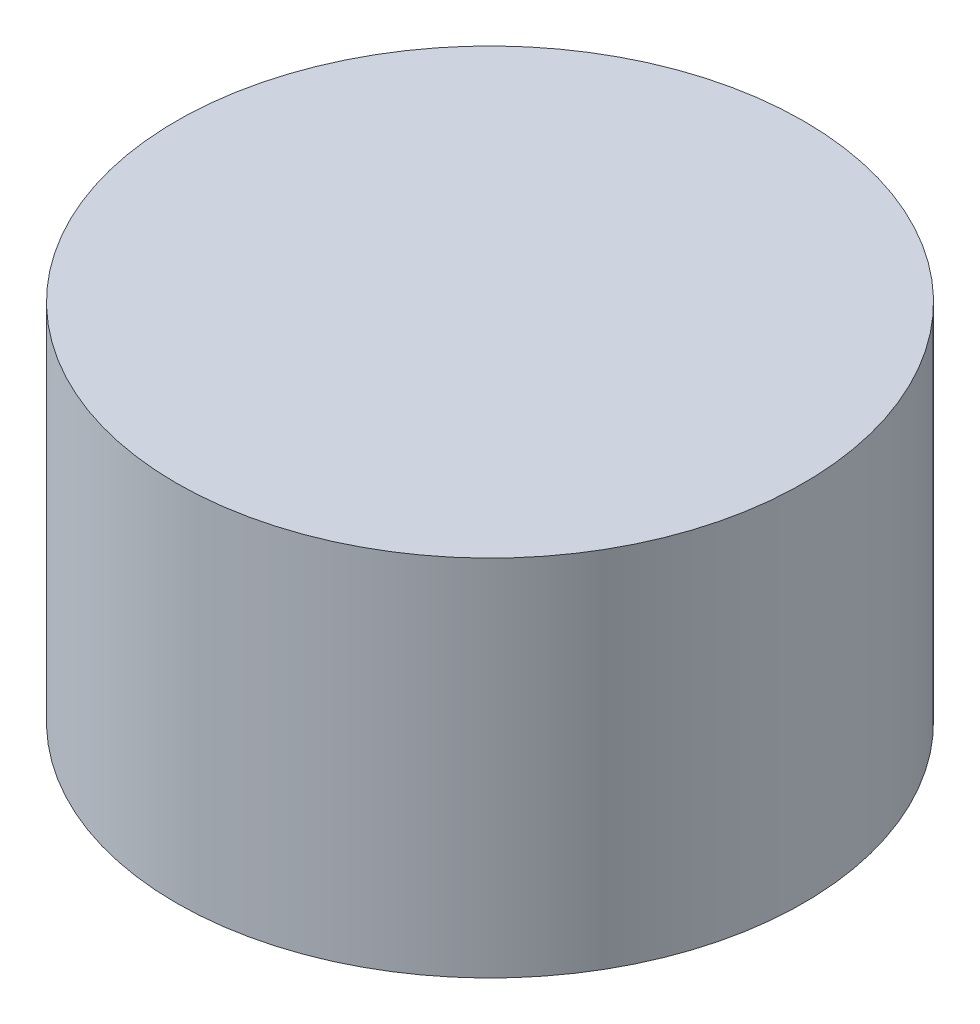
from build123d import *

# Parameters (mm, degrees)
SKETCH1_R           = 1.725
BOSS_EXTRUDE1_DEPTH = 2


with BuildPart() as part:
    # Sketch1 → Boss-Extrude1 (new body)
    with BuildSketch(Plane(origin=(0, 0, 0), x_dir=(1, 0, 0), z_dir=(0, 1, 0))):
        with Locations(Location((0, 0, 0), (0, 0, 270))):
            Circle(SKETCH1_R)
    extrude(amount=BOSS_EXTRUDE1_DEPTH)


solid = part.part
